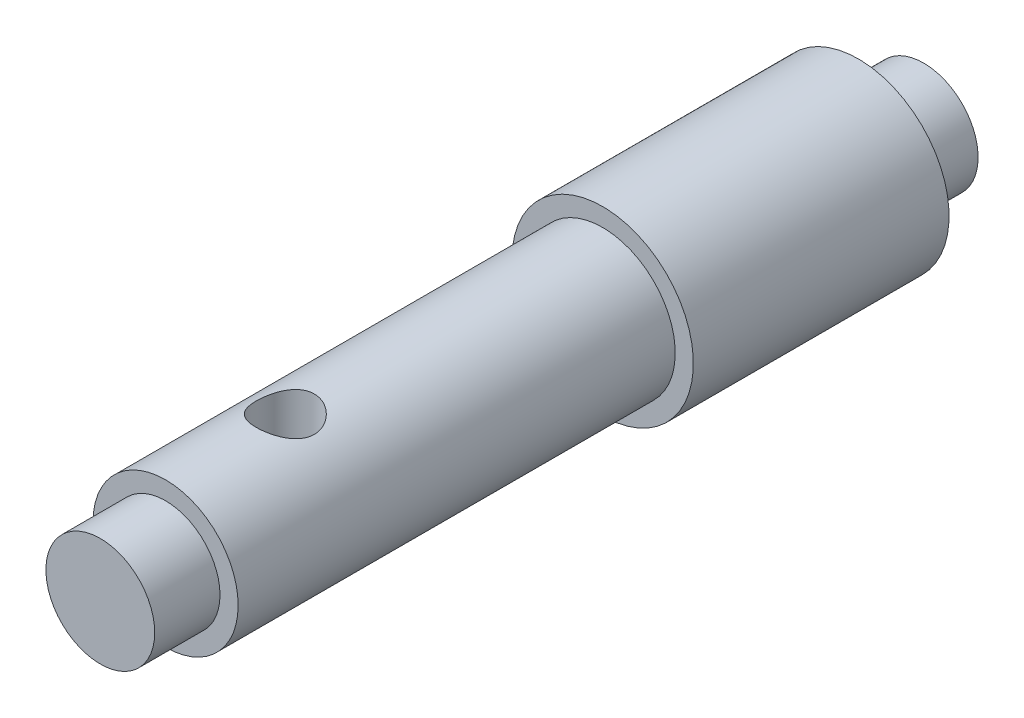
from build123d import *

# Parameters (mm, degrees)
SKETCH_1_R               = 4
EXTRUDE_1_DEPTH          = 45.4
SKETCH_2_R               = 4
SKETCH_2_R_2             = 3
CUT_EXTRUDE_1_DEPTH      = 3.6
CUT_EXTRUDE_START        = -3.6
SKETCH_3_R               = 4
SKETCH_3_R_2             = 3
CUT_EXTRUDE_2_DEPTH      = 3.6
CUT_EXTRUDE_3_DEPTH      = 46.751065561
CUT_EXTRUDE_3_DEPTH_BACK = 46.751065561
SKETCH_4_R               = 1.6
SKETCH_5_R               = 5
SKETCH_5_R_2             = 4
EXTRUDE_2_DEPTH          = 14.1


with BuildPart() as part:
    # ｽｹｯﾁ1 → ﾎﾞｽ - 押し出し1 (new body)
    with BuildSketch(Plane.XY):
        Circle(SKETCH_1_R)
    extrude(amount=EXTRUDE_1_DEPTH)

    # ｽｹｯﾁ2 → ｶｯﾄ - 押し出し1 (cut)
    with BuildSketch(Plane(origin=(0, 0, 0), x_dir=(-1, 0, 0), z_dir=(0, 0, -1))):
        Circle(SKETCH_2_R)
        Circle(SKETCH_2_R_2, mode=Mode.SUBTRACT)
    extrude(amount=-CUT_EXTRUDE_1_DEPTH, mode=Mode.SUBTRACT)

    # ｽｹｯﾁ3 → ｶｯﾄ - 押し出し2 (cut)
    with BuildSketch(Plane.XY.offset(45.4).offset(CUT_EXTRUDE_START)):
        with Locations(Location((0, 0, 0), (0, 0, 180))):
            Circle(SKETCH_3_R)
        with Locations(Location((0, 0, 0), (0, 0, 180))):
            Circle(SKETCH_3_R_2, mode=Mode.SUBTRACT)
    extrude(amount=CUT_EXTRUDE_2_DEPTH, mode=Mode.SUBTRACT)

    # ｽｹｯﾁ4 → ｶｯﾄ - 押し出し3 (cut, two sides: drawn at the far end of the back side and taken through both)
    with BuildSketch(Plane(origin=(0, 0, 0), x_dir=(1, 0, 0), z_dir=(0, 1, 0)).offset(-CUT_EXTRUDE_3_DEPTH_BACK)):
        with Locations(Location((0, -35.2, 0), (0, 0, 270))):
            Circle(SKETCH_4_R)
    extrude(amount=CUT_EXTRUDE_3_DEPTH + CUT_EXTRUDE_3_DEPTH_BACK, mode=Mode.SUBTRACT)

    # ｽｹｯﾁ5 → ﾎﾞｽ - 押し出し2 (add)
    with BuildSketch(Plane(origin=(0, 0, 3.6), x_dir=(-1, 0, 0), z_dir=(0, 0, -1))):
        Circle(SKETCH_5_R)
        Circle(SKETCH_5_R_2, mode=Mode.SUBTRACT)
    extrude(amount=-EXTRUDE_2_DEPTH)


solid = part.part
